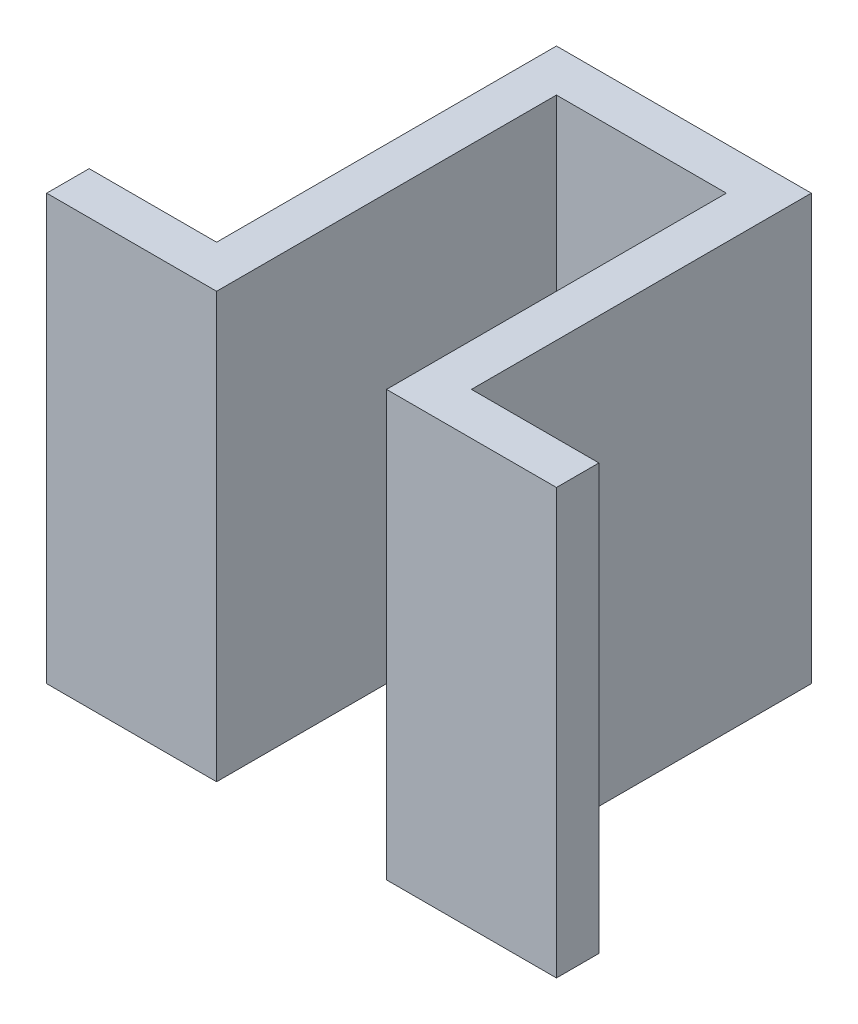
from build123d import *

# Parameters (mm, degrees)
BOSS_EXTRUDE1_DEPTH = 127


with BuildPart() as part:
    # Sketch1 → Boss-Extrude1 (new body)
    with BuildSketch(Plane(origin=(0, 0, 0), x_dir=(1, 0, 0), z_dir=(0, 1, 0))):
        Polygon((76.2, -88.9), (76.2, -101.6), (25.4, -101.6), (25.4, 0), (-25.4, 0), (-25.4, -101.6), (-76.2, -101.6), (-76.2, -88.9), (-38.1, -88.9), (-38.1, 12.7), (38.1, 12.7), (38.1, -88.9), align=None)
    extrude(amount=BOSS_EXTRUDE1_DEPTH)


solid = part.part
